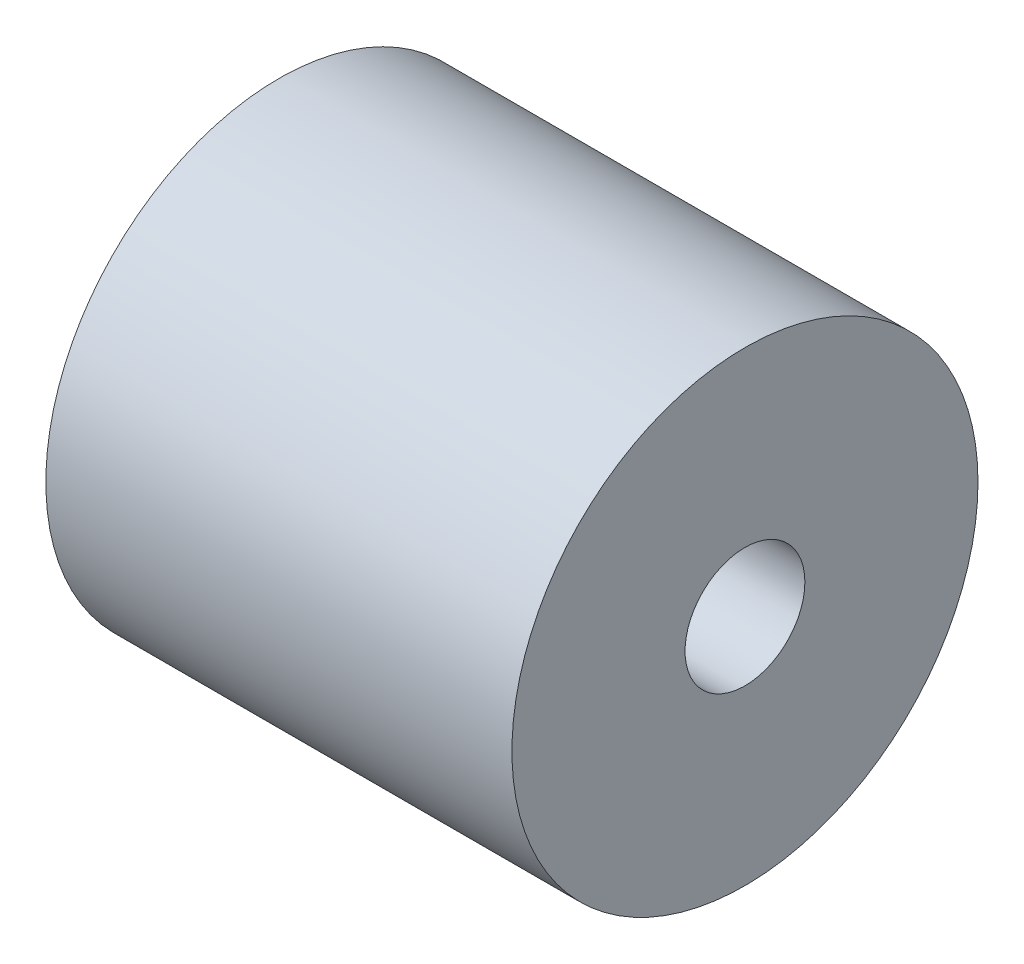
from build123d import *

# Parameters (mm, degrees)
SKETCH1_R           = 7
SKETCH1_R_2         = 1.8
BOSS_EXTRUDE1_DEPTH = 14


with BuildPart() as part:
    # Sketch1 → Boss-Extrude1 (new body)
    with BuildSketch(Plane(origin=(0, 0, 0), x_dir=(0, 0, -1), z_dir=(1, 0, 0))):
        Circle(SKETCH1_R)
        Circle(SKETCH1_R_2, mode=Mode.SUBTRACT)
    extrude(amount=BOSS_EXTRUDE1_DEPTH)


solid = part.part
